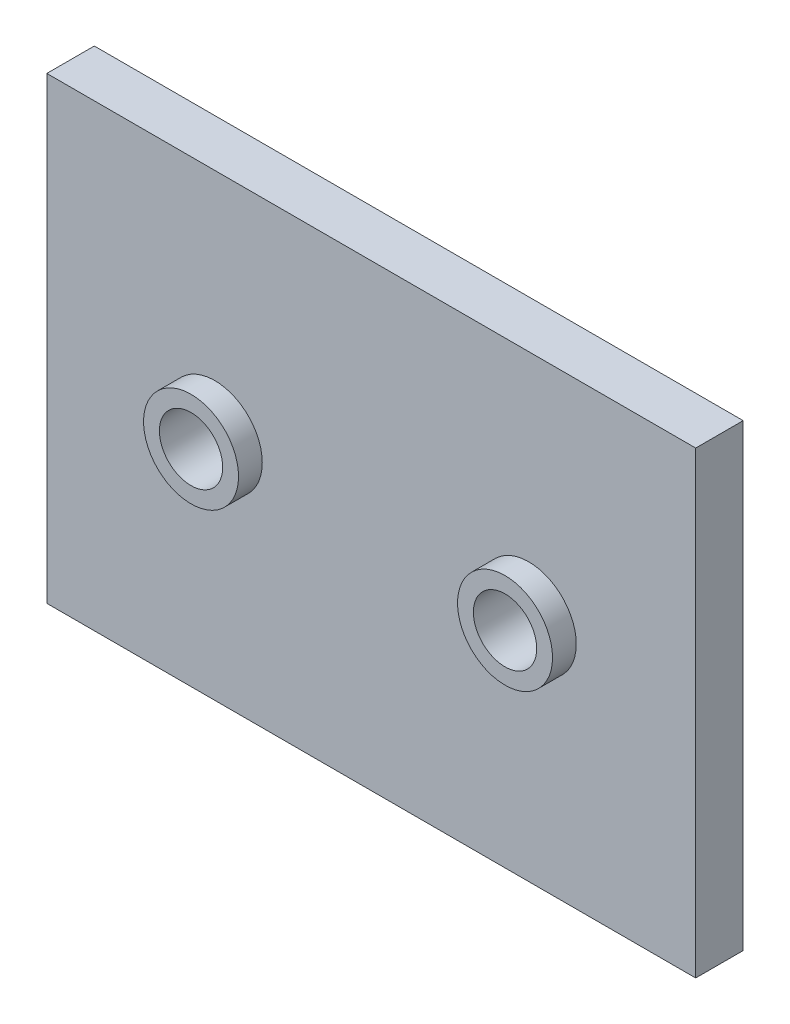
from build123d import *

# Parameters (mm, degrees)
SKETCH1_W                = 41
SKETCH1_H                = 29
BOSS_EXTRUDE1_DEPTH      = 3
SKETCH11_R               = 3
BOSS_EXTRUDE2_DEPTH      = 1.5
F_4_0_4_DIAMETER_HOLE1_D = 4


with BuildPart() as part:
    # Sketch1 → Boss-Extrude1 (new body)
    with BuildSketch(Plane.XY):
        Rectangle(SKETCH1_W, SKETCH1_H)
    extrude(amount=BOSS_EXTRUDE1_DEPTH)


with BuildPart() as part_1:
    # Body-Move/Copy1: moved
    add(part.part.moved(Location((0.5, 0.5, 0))))

    # Sketch11 → Boss-Extrude2 (add)
    with BuildSketch(Plane.XY.offset(3)):
        with Locations((-9.387244392, 0.5)):
            Circle(SKETCH11_R)
        with Locations((10.452938647, 0.5)):
            Circle(SKETCH11_R)
    extrude(amount=BOSS_EXTRUDE2_DEPTH)

    # Ø4.0 (4) Diameter Hole1 (through all)
    with Locations(Plane.XY.offset(4.5)):
        with Locations((-9.387244392, 0.5), (10.452938647, 0.5)):
            Hole(F_4_0_4_DIAMETER_HOLE1_D / 2)


with BuildPart() as part_2:
    # Body-Move/Copy8: moved
    add(part_1.part.moved(Location((27.795693281, 0, 0))))


solid = part_2.part
